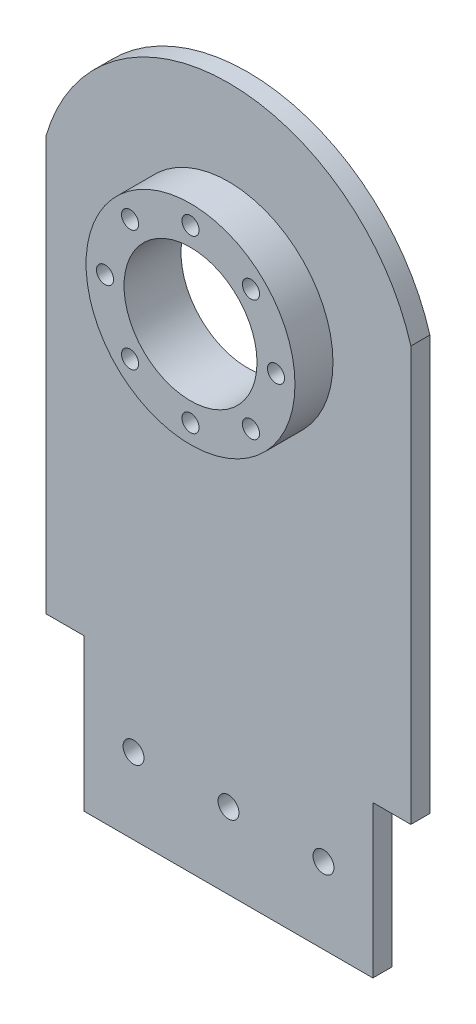
from build123d import *

# Parameters (mm, degrees)
SKETCH_1_R          = 17.5
EXTRUDE_1_DEPTH     = 5
SKETCH_10_W         = 76
SKETCH_10_H         = 40
SKETCH_10_R         = 2.75
EXTRUDE_2_DEPTH     = 5
SKETCH_11_R         = 27.5
SKETCH_11_R_2       = 17.5
EXTRUDE_3_DEPTH     = 10
SKETCH_12_R         = 2.25
CUT_EXTRUDE_6_DEPTH = 40


with BuildPart() as part:
    # 草图1 → 凸台-拉伸1 (new body)
    with BuildSketch(Plane.XY):
        with BuildLine():
            Line((-48, 109.07), (-48, 0))
            Line((-48, 0), (48, 0))
            Line((48, 0), (48, 109.07))
            ThreePointArc((48, 109.07), (0, 145.07), (-48, 109.07))
        make_face()
        with Locations((0, 95.07)):
            Circle(SKETCH_1_R, mode=Mode.SUBTRACT)
    extrude(amount=EXTRUDE_1_DEPTH)

    # 草图10 → 凸台-拉伸2 (add)
    with BuildSketch(Plane.XY.offset(5)):
        with Locations((0, -20)):
            Rectangle(SKETCH_10_W, SKETCH_10_H)
        with Locations((25, -20)):
            Circle(SKETCH_10_R, mode=Mode.SUBTRACT)
        with Locations((-25, -20)):
            Circle(SKETCH_10_R, mode=Mode.SUBTRACT)
        with Locations((0, -20)):
            Circle(SKETCH_10_R, mode=Mode.SUBTRACT)
    extrude(amount=-EXTRUDE_2_DEPTH)

    # 草图11 → 凸台-拉伸3 (add)
    with BuildSketch(Plane.XY.offset(5)):
        with Locations((0, 95.07)):
            Circle(SKETCH_11_R)
        with Locations((0, 95.07)):
            Circle(SKETCH_11_R_2, mode=Mode.SUBTRACT)
    extrude(amount=EXTRUDE_3_DEPTH)

    # 草图12 → 切除-拉伸6 (cut)
    with BuildSketch(Plane.XY.offset(15)):
        with Locations((0, 117.57)):
            Circle(SKETCH_12_R)
        with Locations((15.909902577, 110.979902577)):
            Circle(SKETCH_12_R)
        with Locations((22.5, 95.07)):
            Circle(SKETCH_12_R)
        with Locations((15.909902577, 79.160097423)):
            Circle(SKETCH_12_R)
        with Locations((0, 72.57)):
            Circle(SKETCH_12_R)
        with Locations((-15.909902577, 79.160097423)):
            Circle(SKETCH_12_R)
        with Locations((-22.5, 95.07)):
            Circle(SKETCH_12_R)
        with Locations((-15.909902577, 110.979902577)):
            Circle(SKETCH_12_R)
    extrude(amount=-CUT_EXTRUDE_6_DEPTH, mode=Mode.SUBTRACT)


solid = part.part
